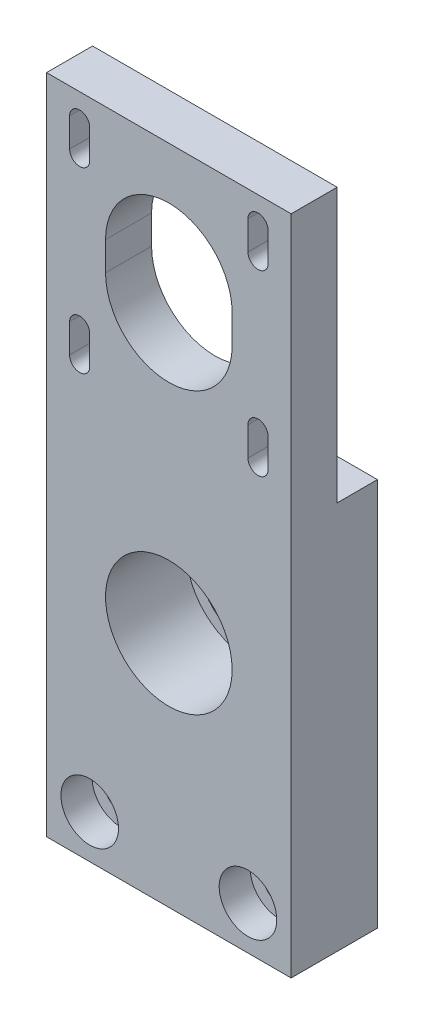
from build123d import *

# Parameters (mm, degrees)
SKIZZE1_W                                            = 42.5
SKIZZE1_H                                            = 115
AUFSATZ_LINEAR_AUSTRAGEN1_DEPTH                      = 15
SKIZZE2_R                                            = 11
SCHNITT_LINEAR_AUSTRAGEN1_DEPTH                      = 14
SKIZZE3_R                                            = 9
SCHNITT_LINEAR_AUSTRAGEN2_DEPTH                      = 14
STIRNSENKUNG_F_R_M5_ZYLINDERSCHRAUBE_MIT_D           = 5.5
STIRNSENKUNG_F_R_M5_ZYLINDERSCHRAUBE_MIT_CBORE_D     = 10
STIRNSENKUNG_F_R_M5_ZYLINDERSCHRAUBE_MIT_CBORE_DEPTH = 5.4
SKIZZE6_W                                            = 7
SKIZZE6_H                                            = 47.5
SCHNITT_LINEAR_AUSTRAGEN3_DEPTH                      = 50


with BuildPart() as part:
    # Skizze1 → Aufsatz-Linear austragen1 (new body)
    with BuildSketch(Plane.XY):
        with Locations((21.25, 57.5)):
            Rectangle(SKIZZE1_W, SKIZZE1_H)
        with BuildLine():
            Line((32.25, 95), (32.25, 90))
            ThreePointArc((32.25, 90), (21.25, 79), (10.25, 90))
            Line((10.25, 90), (10.25, 95))
            ThreePointArc((10.25, 95), (21.25, 106), (32.25, 95))
        make_face(mode=Mode.SUBTRACT)
        with BuildLine():
            Line((7.5, 110.5), (7.5, 105.5))
            ThreePointArc((7.5, 105.5), (5.75, 103.75), (4, 105.5))
            Line((4, 105.5), (4, 110.5))
            ThreePointArc((4, 110.5), (5.75, 112.25), (7.5, 110.5))
        make_face(mode=Mode.SUBTRACT)
        with BuildLine():
            Line((38.5, 110.5), (38.5, 105.5))
            ThreePointArc((38.5, 105.5), (36.75, 103.75), (35, 105.5))
            Line((35, 105.5), (35, 110.5))
            ThreePointArc((35, 110.5), (36.75, 112.25), (38.5, 110.5))
        make_face(mode=Mode.SUBTRACT)
        with BuildLine():
            Line((38.5, 79.5), (38.5, 74.5))
            ThreePointArc((38.5, 74.5), (36.75, 72.75), (35, 74.5))
            Line((35, 74.5), (35, 79.5))
            ThreePointArc((35, 79.5), (36.75, 81.25), (38.5, 79.5))
        make_face(mode=Mode.SUBTRACT)
        with BuildLine():
            Line((7.5, 79.5), (7.5, 74.5))
            ThreePointArc((7.5, 74.5), (5.75, 72.75), (4, 74.5))
            Line((4, 74.5), (4, 79.5))
            ThreePointArc((4, 79.5), (5.75, 81.25), (7.5, 79.5))
        make_face(mode=Mode.SUBTRACT)
    extrude(amount=AUFSATZ_LINEAR_AUSTRAGEN1_DEPTH)

    # Skizze2 → Schnitt-Linear austragen1 (cut)
    with BuildSketch(Plane.XY.offset(15)):
        with Locations((21.25, 41.25)):
            Circle(SKIZZE2_R)
    extrude(amount=-SCHNITT_LINEAR_AUSTRAGEN1_DEPTH, mode=Mode.SUBTRACT)

    # Skizze3 → Schnitt-Linear austragen2 (cut)
    with BuildSketch(Plane.XY.offset(1)):
        with Locations((21.25, 41.25)):
            Circle(SKIZZE3_R)
    extrude(amount=-SCHNITT_LINEAR_AUSTRAGEN2_DEPTH, mode=Mode.SUBTRACT)

    # Stirnsenkung für M5 Zylinderschraube mit Innensechskant1 (through all)
    with Locations(Plane(origin=(35, 7.5, 15), x_dir=(1, 0, 0), z_dir=(0, 0, 1))):
        with Locations((0, 0), (-27.5, 0)):
            CounterBoreHole(STIRNSENKUNG_F_R_M5_ZYLINDERSCHRAUBE_MIT_D / 2, STIRNSENKUNG_F_R_M5_ZYLINDERSCHRAUBE_MIT_CBORE_D / 2, STIRNSENKUNG_F_R_M5_ZYLINDERSCHRAUBE_MIT_CBORE_DEPTH)

    # Skizze6 → Schnitt-Linear austragen3 (cut)
    with BuildSketch(Plane(origin=(42.5, 0, 0), x_dir=(0, 0, -1), z_dir=(1, 0, 0))):
        with Locations((-3.5, 91.25)):
            Rectangle(SKIZZE6_W, SKIZZE6_H)
    extrude(amount=-SCHNITT_LINEAR_AUSTRAGEN3_DEPTH, mode=Mode.SUBTRACT)


solid = part.part
